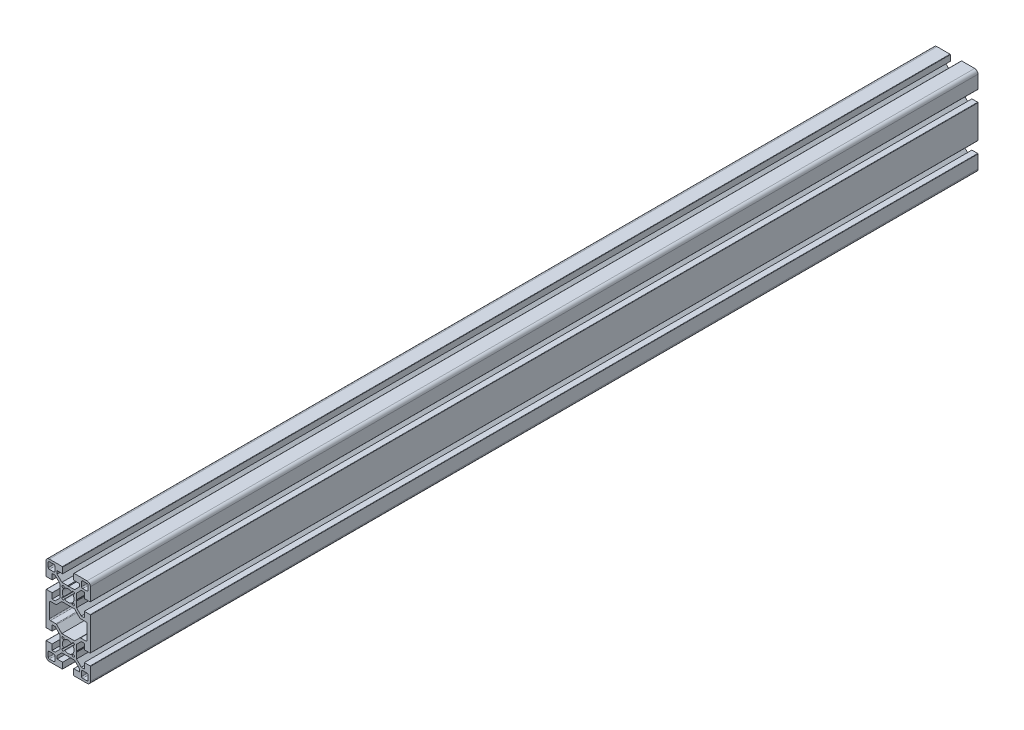
from build123d import *

# Parameters (mm, degrees)
BOSS_EXTRUDE1_DEPTH = 800


with BuildPart() as part:
    # Sketch3 → Boss-Extrude1 (new body)
    with BuildSketch(Plane.XY):
        with BuildLine():
            Line((-17, -40), (-5.3, -40))
            ThreePointArc((-5.3, -40), (-5.087867966, -39.912132034), (-5, -39.7))
            Line((-5, -39.7), (-5, -34.5))
            Line((-5, -34.5), (-10.000001, -34.5))
            Line((-10.000001, -34.5), (-10.000001, -31.767757))
            Line((-10.000001, -31.767757), (-5.732248, -27.5))
            Line((-5.732248, -27.5), (-0.519615242, -27.5))
            Line((-0.519615242, -27.5), (0, -27.2))
            Line((0, -27.2), (0.519615242, -27.5))
            Line((0.519615242, -27.5), (5.732247, -27.5))
            Line((5.732247, -27.5), (9.999994, -31.767757))
            Line((9.999994, -31.767757), (9.999994, -34.5))
            Line((9.999994, -34.5), (5, -34.5))
            Line((5, -34.5), (5, -39.7))
            ThreePointArc((5, -39.7), (5.087867966, -39.912132034), (5.3, -40))
            Line((5.3, -40), (17, -40))
            ThreePointArc((17, -40), (19.121320344, -39.121320344), (20, -37))
            Line((20, -37), (20, -25.3))
            ThreePointArc((20, -25.3), (19.912132034, -25.087867966), (19.7, -25))
            Line((19.7, -25), (14.5, -25))
            Line((14.5, -25), (14.5, -30))
            Line((14.5, -30), (11.767785, -30))
            Line((11.767785, -30), (7.5, -25.73223))
            Line((7.5, -25.73223), (7.5, -20.519615242))
            Line((7.5, -20.519615242), (7.2, -20))
            Line((7.2, -20), (7.5, -19.480384758))
            Line((7.5, -19.480384758), (7.5, -14.267762))
            Line((7.5, -14.267762), (11.767767, -10))
            Line((11.767767, -10), (14.5, -10))
            Line((14.5, -10), (14.5, -15))
            Line((14.5, -15), (19.7, -15))
            ThreePointArc((19.7, -15), (19.912132034, -14.912132034), (20, -14.7))
            Line((20, -14.7), (20, 14.7))
            ThreePointArc((20, 14.7), (19.912132034, 14.912132034), (19.7, 15))
            Line((19.7, 15), (14.5, 15))
            Line((14.5, 15), (14.5, 10))
            Line((14.5, 10), (11.767785, 10))
            Line((11.767785, 10), (7.5, 14.26777))
            Line((7.5, 14.26777), (7.5, 19.480384758))
            Line((7.5, 19.480384758), (7.2, 20))
            Line((7.2, 20), (7.5, 20.519615242))
            Line((7.5, 20.519615242), (7.5, 25.732238))
            Line((7.5, 25.732238), (11.767767, 30))
            Line((11.767767, 30), (14.5, 30))
            Line((14.5, 30), (14.5, 25))
            Line((14.5, 25), (19.7, 25))
            ThreePointArc((19.7, 25), (19.912132034, 25.087867966), (20, 25.3))
            Line((20, 25.3), (20, 37))
            ThreePointArc((20, 37), (19.121320344, 39.121320344), (17, 40))
            Line((17, 40), (5.3, 40))
            ThreePointArc((5.3, 40), (5.087867966, 39.912132034), (5, 39.7))
            Line((5, 39.7), (5, 34.5))
            Line((5, 34.5), (10.000001, 34.5))
            Line((10.000001, 34.5), (10.000001, 31.767778))
            Line((10.000001, 31.767778), (5.73223, 27.5))
            Line((5.73223, 27.5), (0.519615242, 27.5))
            Line((0.519615242, 27.5), (0, 27.2))
            Line((0, 27.2), (-0.519615242, 27.5))
            Line((-0.519615242, 27.5), (-5.732231, 27.5))
            Line((-5.732231, 27.5), (-10, 31.767777))
            Line((-10, 31.767777), (-10, 34.5))
            Line((-10, 34.5), (-5, 34.5))
            Line((-5, 34.5), (-5, 39.7))
            ThreePointArc((-5, 39.7), (-5.087867966, 39.912132034), (-5.3, 40))
            Line((-5.3, 40), (-17, 40))
            ThreePointArc((-17, 40), (-19.121320344, 39.121320344), (-20, 37))
            Line((-20, 37), (-20, 25.3))
            ThreePointArc((-20, 25.3), (-19.912132034, 25.087867966), (-19.7, 25))
            Line((-19.7, 25), (-14.5, 25))
            Line((-14.5, 25), (-14.5, 30))
            Line((-14.5, 30), (-11.767763, 30))
            Line((-11.767763, 30), (-7.5, 25.732237))
            Line((-7.5, 25.732237), (-7.5, 20.519615242))
            Line((-7.5, 20.519615242), (-7.2, 20))
            Line((-7.2, 20), (-7.5, 19.480384758))
            Line((-7.5, 19.480384758), (-7.5, 14.267771))
            Line((-7.5, 14.267771), (-11.767786, 10))
            Line((-11.767786, 10), (-14.5, 10))
            Line((-14.5, 10), (-14.5, 15))
            Line((-14.5, 15), (-19.7, 15))
            ThreePointArc((-19.7, 15), (-19.912132034, 14.912132034), (-20, 14.7))
            Line((-20, 14.7), (-20, -14.7))
            ThreePointArc((-20, -14.7), (-19.912132034, -14.912132034), (-19.7, -15))
            Line((-19.7, -15), (-14.5, -15))
            Line((-14.5, -15), (-14.5, -10))
            Line((-14.5, -10), (-11.767763, -10))
            Line((-11.767763, -10), (-7.5, -14.267763))
            Line((-7.5, -14.267763), (-7.5, -19.480384758))
            Line((-7.5, -19.480384758), (-7.2, -20))
            Line((-7.2, -20), (-7.5, -20.519615242))
            Line((-7.5, -20.519615242), (-7.5, -25.732229))
            Line((-7.5, -25.732229), (-11.767786, -30))
            Line((-11.767786, -30), (-14.5, -30))
            Line((-14.5, -30), (-14.5, -25))
            Line((-14.5, -25), (-19.7, -25))
            ThreePointArc((-19.7, -25), (-19.912132034, -25.087867966), (-20, -25.3))
            Line((-20, -25.3), (-20, -37))
            ThreePointArc((-20, -37), (-19.121320344, -39.121320344), (-17, -40))
        make_face()
        with BuildLine():
            Line((12, -33), (12, -37))
            ThreePointArc((12, -37), (12.292893219, -37.707106781), (13, -38))
            Line((13, -38), (17, -38))
            ThreePointArc((17, -38), (17.707106781, -37.707106781), (18, -37))
            Line((18, -37), (18, -33))
            ThreePointArc((18, -33), (17.707106781, -32.292893219), (17, -32))
            Line((17, -32), (13, -32))
            ThreePointArc((13, -32), (12.292893219, -32.292893219), (12, -33))
        make_face(mode=Mode.SUBTRACT)
        with BuildLine():
            Line((12, 37), (12, 33))
            ThreePointArc((12, 33), (12.292893219, 32.292893219), (13, 32))
            Line((13, 32), (17, 32))
            ThreePointArc((17, 32), (17.707106781, 32.292893219), (18, 33))
            Line((18, 33), (18, 37))
            ThreePointArc((18, 37), (17.707106781, 37.707106781), (17, 38))
            Line((17, 38), (13, 38))
            ThreePointArc((13, 38), (12.292893219, 37.707106781), (12, 37))
        make_face(mode=Mode.SUBTRACT)
        with BuildLine():
            Line((-16, -7.5), (-11.146435739, -7.5))
            ThreePointArc((-11.146435739, -7.5), (-10.763751874, -7.576120647), (-10.439328295, -7.792893882))
            Line((-10.439328295, -7.792893882), (-5.732231, -12.5))
            Line((-5.732231, -12.5), (5.73223, -12.5))
            Line((5.73223, -12.5), (10.439328481, -7.792893799))
            ThreePointArc((10.439328481, -7.792893799), (10.763752031, -7.576120624), (11.146435842, -7.5))
            Line((11.146435842, -7.5), (16, -7.5))
            ThreePointArc((16, -7.5), (16.707106781, -7.207106781), (17, -6.5))
            Line((17, -6.5), (17, 6.5))
            ThreePointArc((17, 6.5), (16.707106781, 7.207106781), (16, 7.5))
            Line((16, 7.5), (11.146449533, 7.5))
            ThreePointArc((11.146449533, 7.5), (10.763765559, 7.576120692), (10.439341923, 7.792894047))
            Line((10.439341923, 7.792894047), (5.732247, 12.5))
            Line((5.732247, 12.5), (-5.732248, 12.5))
            Line((-5.732248, 12.5), (-10.439350038, 7.79289355))
            ThreePointArc((-10.439350038, 7.79289355), (-10.763773502, 7.576120557), (-11.146457151, 7.5))
            Line((-11.146457151, 7.5), (-16, 7.5))
            ThreePointArc((-16, 7.5), (-16.707106781, 7.207106781), (-17, 6.5))
            Line((-17, 6.5), (-17, -6.5))
            ThreePointArc((-17, -6.5), (-16.707106781, -7.207106781), (-16, -7.5))
        make_face(mode=Mode.SUBTRACT)
        with BuildLine():
            Line((-18, 37), (-18, 33))
            ThreePointArc((-18, 33), (-17.707106781, 32.292893219), (-17, 32))
            Line((-17, 32), (-13, 32))
            ThreePointArc((-13, 32), (-12.292893219, 32.292893219), (-12, 33))
            Line((-12, 33), (-12, 37))
            ThreePointArc((-12, 37), (-12.292893219, 37.707106781), (-13, 38))
            Line((-13, 38), (-17, 38))
            ThreePointArc((-17, 38), (-17.707106781, 37.707106781), (-18, 37))
        make_face(mode=Mode.SUBTRACT)
        with BuildLine():
            Line((-18, -33), (-18, -37))
            ThreePointArc((-18, -37), (-17.707106781, -37.707106781), (-17, -38))
            Line((-17, -38), (-13, -38))
            ThreePointArc((-13, -38), (-12.292893219, -37.707106781), (-12, -37))
            Line((-12, -37), (-12, -33))
            ThreePointArc((-12, -33), (-12.292893219, -32.292893219), (-13, -32))
            Line((-13, -32), (-17, -32))
            ThreePointArc((-17, -32), (-17.707106781, -32.292893219), (-18, -33))
        make_face(mode=Mode.SUBTRACT)
        with BuildLine():
            ThreePointArc((-3.596260884, 24.607953771), (-5.303809323, 25.30278657), (-4.606509157, 23.596244226))
            ThreePointArc((-4.606509157, 23.596244226), (-4.28245073, 23.387865247), (-4.306109146, 23.003318835))
            ThreePointArc((-4.306109146, 23.003318835), (-5.249999999, 20.000075464), (-4.306195484, 16.996804959))
            ThreePointArc((-4.306195484, 16.996804959), (-4.2822647, 16.612495539), (-4.605831196, 16.403758539))
            ThreePointArc((-4.605831196, 16.403758539), (-5.30321925, 14.696618996), (-3.596236026, 15.394389581))
            ThreePointArc((-3.596236026, 15.394389581), (-3.387547534, 15.717718991), (-3.003451934, 15.693983688))
            ThreePointArc((-3.003451934, 15.693983688), (-6.422e-06, 14.75), (3.003441399, 15.69397634))
            ThreePointArc((3.003441399, 15.69397634), (3.387737183, 15.717617411), (3.596240681, 15.393937878))
            ThreePointArc((3.596240681, 15.393937878), (5.303398553, 14.696798004), (4.605776919, 16.403759064))
            ThreePointArc((4.605776919, 16.403759064), (4.28189959, 16.613183993), (4.307063747, 16.998050321))
            ThreePointArc((4.307063747, 16.998050321), (5.249999869, 20.001173377), (4.305721443, 23.00387464))
            ThreePointArc((4.305721443, 23.00387464), (4.282434158, 23.38786573), (4.60581127, 23.596237266))
            ThreePointArc((4.60581127, 23.596237266), (5.303387727, 25.303208824), (3.596240718, 24.60606185))
            ThreePointArc((3.596240718, 24.60606185), (3.387657063, 24.2823423), (3.003292957, 24.306127195))
            ThreePointArc((3.003292957, 24.306127195), (-3.7648e-05, 25.25), (-3.003354715, 24.306084121))
            ThreePointArc((-3.003354715, 24.306084121), (-3.388519532, 24.28277906), (-3.596260884, 24.607953771))
        make_face(mode=Mode.SUBTRACT)
        with BuildLine():
            ThreePointArc((-3.596260884, -15.392046229), (-5.303809323, -14.69721343), (-4.606509157, -16.403755774))
            ThreePointArc((-4.606509157, -16.403755774), (-4.28245073, -16.612134753), (-4.306109146, -16.996681165))
            ThreePointArc((-4.306109146, -16.996681165), (-5.249999999, -19.999924536), (-4.306195484, -23.003195041))
            ThreePointArc((-4.306195484, -23.003195041), (-4.2822647, -23.387504461), (-4.605831196, -23.596241461))
            ThreePointArc((-4.605831196, -23.596241461), (-5.30321925, -25.303381004), (-3.596236026, -24.605610419))
            ThreePointArc((-3.596236026, -24.605610419), (-3.387547534, -24.282281009), (-3.003451934, -24.306016312))
            ThreePointArc((-3.003451934, -24.306016312), (-6.422e-06, -25.25), (3.003441399, -24.30602366))
            ThreePointArc((3.003441399, -24.30602366), (3.387737183, -24.282382589), (3.596240681, -24.606062122))
            ThreePointArc((3.596240681, -24.606062122), (5.303398553, -25.303201996), (4.605776919, -23.596240936))
            ThreePointArc((4.605776919, -23.596240936), (4.28189959, -23.386816007), (4.307063747, -23.001949679))
            ThreePointArc((4.307063747, -23.001949679), (5.249999869, -19.998826623), (4.305721443, -16.99612536))
            ThreePointArc((4.305721443, -16.99612536), (4.282434158, -16.61213427), (4.60581127, -16.403762734))
            ThreePointArc((4.60581127, -16.403762734), (5.303387727, -14.696791176), (3.596240718, -15.39393815))
            ThreePointArc((3.596240718, -15.39393815), (3.387657063, -15.7176577), (3.003292957, -15.693872805))
            ThreePointArc((3.003292957, -15.693872805), (-3.7648e-05, -14.75), (-3.003354715, -15.693915879))
            ThreePointArc((-3.003354715, -15.693915879), (-3.388519532, -15.71722094), (-3.596260884, -15.392046229))
        make_face(mode=Mode.SUBTRACT)
    extrude(amount=BOSS_EXTRUDE1_DEPTH)


solid = part.part
